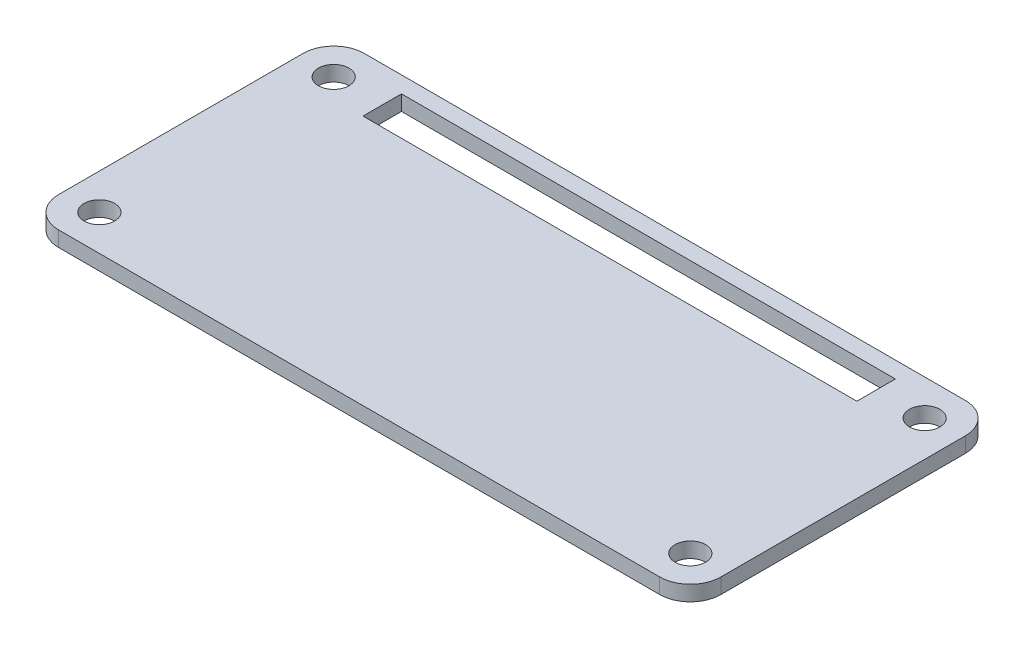
from build123d import *

# Parameters (mm, degrees)
SKETCH1_R           = 1.5
SKETCH1_W           = 48.470262398
SKETCH1_H           = 3.779033876
BOSS_EXTRUDE1_DEPTH = 1.5


with BuildPart() as part:
    # Sketch1 → Boss-Extrude1 (new body)
    with BuildSketch(Plane(origin=(0, 0, 0), x_dir=(1, 0, 0), z_dir=(0, 1, 0))):
        with BuildLine():
            Line((29.5, -15), (-29.5, -15))
            ThreePointArc((-29.5, -15), (-31.621320344, -14.121320344), (-32.5, -12))
            Line((-32.5, -12), (-32.5, 12))
            ThreePointArc((-32.5, 12), (-31.621320344, 14.121320344), (-29.5, 15))
            Line((-29.5, 15), (29.5, 15))
            ThreePointArc((29.5, 15), (31.621320344, 14.121320344), (32.5, 12))
            Line((32.5, 12), (32.5, -12))
            ThreePointArc((32.5, -12), (31.621320344, -14.121320344), (29.5, -15))
        make_face()
        with Locations(Location((-29, 11.5, 0), (0, 0, 270))):
            Circle(SKETCH1_R, mode=Mode.SUBTRACT)
        with Locations(Location((29, 11.5, 0), (0, 0, 270))):
            Circle(SKETCH1_R, mode=Mode.SUBTRACT)
        with Locations(Location((29, -11.5, 0), (0, 0, 270))):
            Circle(SKETCH1_R, mode=Mode.SUBTRACT)
        with Locations(Location((-29, -11.5, 0), (0, 0, 270))):
            Circle(SKETCH1_R, mode=Mode.SUBTRACT)
        with Locations((0, 11.5)):
            Rectangle(SKETCH1_W, SKETCH1_H, mode=Mode.SUBTRACT)
    extrude(amount=BOSS_EXTRUDE1_DEPTH)


solid = part.part
